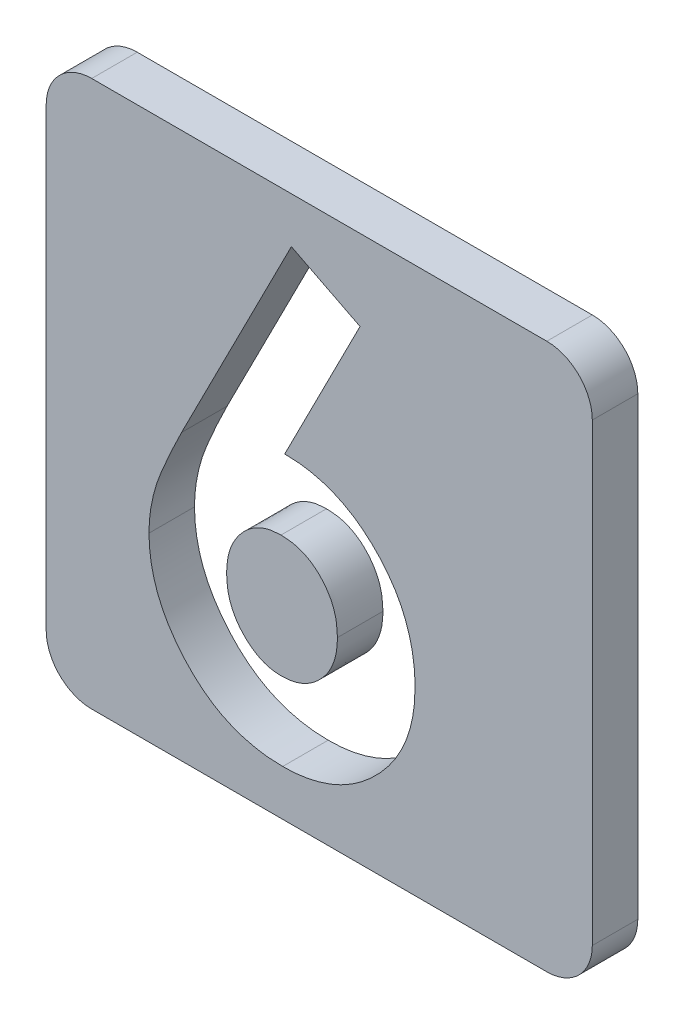
from build123d import *

# Parameters (mm, degrees)
BOSS_EXTRUDE1_DEPTH = 10
CUT_EXTRUDE4_DEPTH  = 10


with BuildPart() as part:
    # Sketch1 → Boss-Extrude1 (new body)
    with BuildSketch(Plane.XY):
        with BuildLine():
            Line((-50, 60), (50, 60))
            ThreePointArc((50, 60), (57.071067812, 57.071067812), (60, 50))
            Line((60, 50), (60, -50))
            ThreePointArc((60, -50), (57.071067812, -57.071067812), (50, -60))
            Line((50, -60), (-50, -60))
            ThreePointArc((-50, -60), (-57.071067812, -57.071067812), (-60, -50))
            Line((-60, -50), (-60, 50))
            ThreePointArc((-60, 50), (-57.071067812, 57.071067812), (-50, 60))
        make_face()
    extrude(amount=BOSS_EXTRUDE1_DEPTH)

    # Sketch2 → Cut-Extrude4 (cut)
    with BuildSketch(Plane.XY.offset(10)):
        with BuildLine():
            Line((-6.124198718, 49.935897436), (8.966947115, 42.285657051))
            Line((8.966947115, 42.285657051), (-7.589543269, 9.743589744))
            add(Edge.make_bspline(
                [(-7.589543269, 9.743589744), (-6.611401353, 9.718265156), (-4.684790438, 9.668384228), (-1.850173407, 9.265238226), (0.859773239, 8.568295456), (3.472373776, 7.644499699), (5.955691637, 6.403832822), (8.349722036, 4.927994847), (10.5925302, 3.128051695), (12.735541798, 1.133810178), (14.684171235, -1.075522815), (16.376900405, -3.4495213), (17.852083993, -5.930425603), (18.998832346, -8.573739573), (19.923837754, -11.335647275), (20.591269863, -14.227189241), (20.972058555, -17.25673874), (21.024556627, -19.314848948), (21.051282051, -20.362580128)],
                knots=[0, 0, 0, 0, 1.013260694, 1.995783107, 2.958651975, 3.908806537, 4.861209129, 5.829647963, 6.817170299, 7.835534541, 8.860094905, 9.863329007, 10.853101798, 11.844815043, 12.84250023, 13.867713965, 14.914507806, 16, 16, 16, 16], degree=3))
            add(Edge.make_bspline(
                [(21.051282051, -20.362580128), (21.026238117, -21.372529431), (20.976736999, -23.36876612), (20.567544726, -26.300730118), (19.906268516, -29.113778112), (18.961172021, -31.802292095), (17.759877945, -34.379413601), (16.290776659, -36.84363035), (14.541684822, -39.176528058), (12.557794128, -41.365710829), (10.389059356, -43.361167109), (8.103094783, -45.134844784), (5.680529431, -46.599969838), (3.167152621, -47.837302292), (0.51669155, -48.760620347), (-2.231189506, -49.457565528), (-5.097328522, -49.859733154), (-7.042790252, -49.910306188), (-8.02724359, -49.935897436)],
                knots=[0, 0, 0, 0, 1.049934834, 2.075270938, 3.072134561, 4.05064612, 5.033440221, 6.024524368, 7.028587226, 8.060776465, 9.092543989, 10.090062252, 11.064205434, 12.031961459, 12.998029633, 13.977230324, 14.976426867, 16, 16, 16, 16], degree=3))
            add(Edge.make_bspline(
                [(-8.02724359, -49.935897436), (-9.056682618, -49.914896057), (-11.080935178, -49.873599687), (-14.042923287, -49.411189181), (-16.883724805, -48.715094627), (-19.587373971, -47.72118987), (-22.170683973, -46.455640691), (-24.603240995, -44.889650868), (-26.905535958, -43.040489076), (-29.053023033, -40.949758538), (-30.98774885, -38.65964929), (-32.713362576, -36.281919647), (-34.173234017, -33.812838423), (-35.354965917, -31.255045538), (-36.276980553, -28.616691514), (-36.918514688, -25.892768969), (-37.336533382, -23.090503107), (-37.385536538, -21.188726918), (-37.41025641, -20.229366987)],
                knots=[0, 0, 0, 0, 1.063775006, 2.091769615, 3.092589432, 4.084662827, 5.064601646, 6.061867366, 7.070035304, 8.113879863, 9.156342271, 10.166834137, 11.149076039, 12.117706134, 13.076241869, 14.034148791, 15.008317125, 16, 16, 16, 16], degree=3))
            add(Edge.make_bspline(
                [(-37.41025641, -20.229366987), (-37.397194915, -19.48645495), (-37.37099922, -17.996495521), (-37.107748141, -15.765362242), (-36.707514033, -13.528372449), (-36.243590299, -11.640729627), (-35.765888506, -10.044530074), (-35.285077983, -8.693709525), (-34.68921928, -7.194594085), (-34.008064519, -5.54335562), (-33.220193861, -3.741980566), (-32.329723004, -1.795379002), (-31.334435069, 0.311190202), (-30.624657691, 1.758077055), (-30.254807692, 2.512019231)],
                knots=[0, 0, 0, 0, 1.110454016, 2.227089276, 3.35462975, 4.507227546, 5.131400587, 5.845402449, 6.650387134, 7.543487832, 8.516250726, 9.590168902, 10.744287919, 12, 12, 12, 12], degree=3))
            Line((-30.254807692, 2.512019231), (-6.124198718, 49.935897436))
        make_face()
        with BuildLine():
            add(Edge.make_bspline(
                [(-8.407852564, -6.08974359), (-9.226024974, -6.127271429), (-10.827080981, -6.200708486), (-13.103543184, -6.969777088), (-15.179160216, -8.176254317), (-16.978330731, -9.856507181), (-18.48317132, -11.864475335), (-19.588980983, -14.154831224), (-20.254186954, -16.697010679), (-20.323297594, -18.474460173), (-20.358974359, -19.392027244)],
                knots=[0, 0, 0, 0, 0.981744412, 1.921144944, 2.858899012, 3.85339082, 4.86292663, 5.863643845, 6.897155691, 8, 8, 8, 8], degree=3))
            add(Edge.make_bspline(
                [(-20.358974359, -19.392027244), (-20.316731952, -20.309899867), (-20.234567647, -22.095223475), (-19.544349062, -24.661609016), (-18.414247075, -27.003976231), (-16.829351099, -29.038554326), (-14.968706005, -30.727411663), (-12.905471285, -31.976402421), (-10.674062437, -32.743698427), (-9.130542441, -32.83731872), (-8.350761218, -32.884615385)],
                knots=[0, 0, 0, 0, 1.098279937, 2.136227893, 3.159405121, 4.194678092, 5.206500211, 6.154139736, 7.067477469, 8, 8, 8, 8], degree=3))
            add(Edge.make_bspline(
                [(-8.350761218, -32.884615385), (-7.527224111, -32.836476333), (-5.912124811, -32.742067292), (-3.582238145, -32.007057701), (-1.453872696, -30.778991633), (0.428014058, -29.095541313), (2.044519018, -27.084180493), (3.162977168, -24.728054541), (3.885104863, -22.143145743), (3.960842941, -20.329627504), (4, -19.392027244)],
                knots=[0, 0, 0, 0, 0.96921794, 1.900804717, 2.848419905, 3.844199796, 4.861108892, 5.867439427, 6.897452859, 8, 8, 8, 8], degree=3))
            add(Edge.make_bspline(
                [(4, -19.392027244), (3.955392956, -18.474995927), (3.869006208, -16.69905771), (3.220139362, -14.144968729), (2.061631424, -11.863440716), (0.522742602, -9.848218605), (-1.338345813, -8.168714968), (-3.49703327, -6.960262431), (-5.877488064, -6.202071026), (-7.552100104, -6.127731982), (-8.407852564, -6.08974359)],
                knots=[0, 0, 0, 0, 1.083229974, 2.097801324, 3.086792542, 4.086858909, 5.079819718, 6.026392613, 6.991456328, 8, 8, 8, 8], degree=3))
        make_face(mode=Mode.SUBTRACT)
    extrude(amount=-CUT_EXTRUDE4_DEPTH, mode=Mode.SUBTRACT)


with BuildPart() as cut_extrude4_piece_1:
    # of the separate pieces the step leaves, piece 1, a body of its own (cut_extrude4_pieces)
    add(part.part.solids().sort_by_distance((-50, 60, 0))[0])


with BuildPart() as cut_extrude4_piece_2:
    # of the separate pieces the step leaves, piece 2, a body of its own (cut_extrude4_pieces)
    add(part.part.solids().sort_by_distance((-8.407852564, -6.08974359, 0))[0])


solid = Compound([cut_extrude4_piece_1.part, cut_extrude4_piece_2.part])
